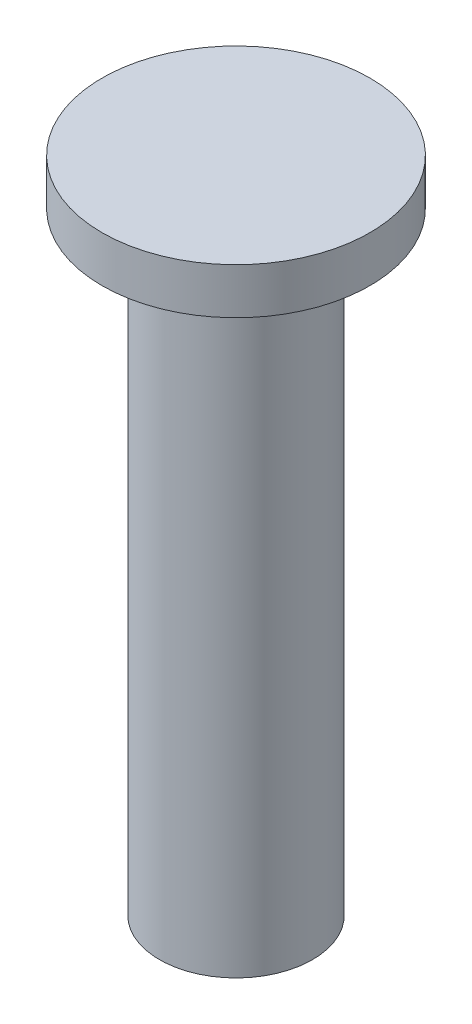
from build123d import *

# Parameters (mm, degrees)
SKETCH_1_R      = 3.5
EXTRUDE_1_DEPTH = 1.2
SKETCH_2_R      = 2
EXTRUDE_2_DEPTH = 16


with BuildPart() as part:
    # 草图1 → 凸台-拉伸1 (new body)
    with BuildSketch(Plane(origin=(0, 0, 0), x_dir=(1, 0, 0), z_dir=(0, 1, 0))):
        with Locations(Location((0, 0, 0), (0, 0, 270))):
            Circle(SKETCH_1_R)
    extrude(amount=EXTRUDE_1_DEPTH)

    # 草图2 → 凸台-拉伸2 (add)
    with BuildSketch(Plane.XZ):
        with Locations(Location((0, 0, 0), (0, 0, 270))):
            Circle(SKETCH_2_R)
    extrude(amount=EXTRUDE_2_DEPTH)


solid = part.part
